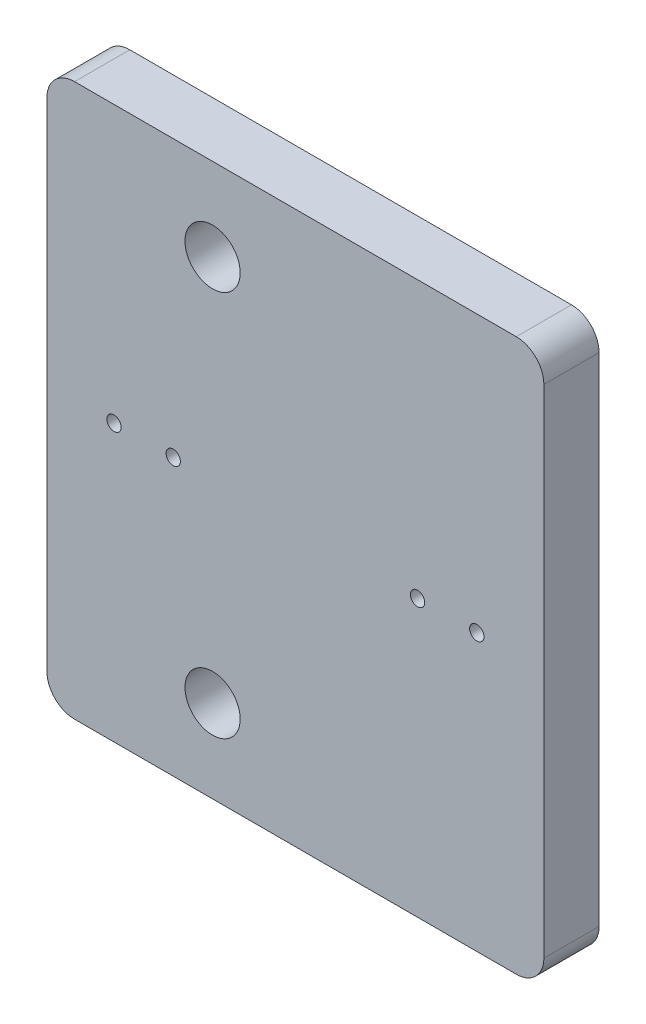
from build123d import *

# Parameters (mm, degrees)
SKETCH1_W           = 114.3
SKETCH1_H           = 127
SKETCH1_R           = 1.651
SKETCH1_R_2         = 6.35
BOSS_EXTRUDE1_DEPTH = 12.7
FILLET1_R           = 6.35


with BuildPart() as part:
    # Sketch1 → Boss-Extrude1 (new body)
    with BuildSketch(Plane.XY):
        Rectangle(SKETCH1_W, SKETCH1_H)
        with Locations((-41.72966, 0)):
            Circle(SKETCH1_R, mode=Mode.SUBTRACT)
        with Locations((-28.09748, 0)):
            Circle(SKETCH1_R, mode=Mode.SUBTRACT)
        with Locations((28.09748, 0)):
            Circle(SKETCH1_R, mode=Mode.SUBTRACT)
        with Locations((41.72966, 0)):
            Circle(SKETCH1_R, mode=Mode.SUBTRACT)
        with Locations((-19.05, 44.45)):
            Circle(SKETCH1_R_2, mode=Mode.SUBTRACT)
        with Locations((-19.05, -44.45)):
            Circle(SKETCH1_R_2, mode=Mode.SUBTRACT)
    extrude(amount=BOSS_EXTRUDE1_DEPTH)

    # Fillet1
    fillet1_edges = [part.edges().sort_by_distance(p)[0] for p in [
        (57.15, -63.5, 6.35),
        (-57.15, -63.5, 6.35),
        (-57.15, 63.5, 6.35),
        (57.15, 63.5, 6.35),
    ]]
    fillet(fillet1_edges, radius=FILLET1_R)


solid = part.part
